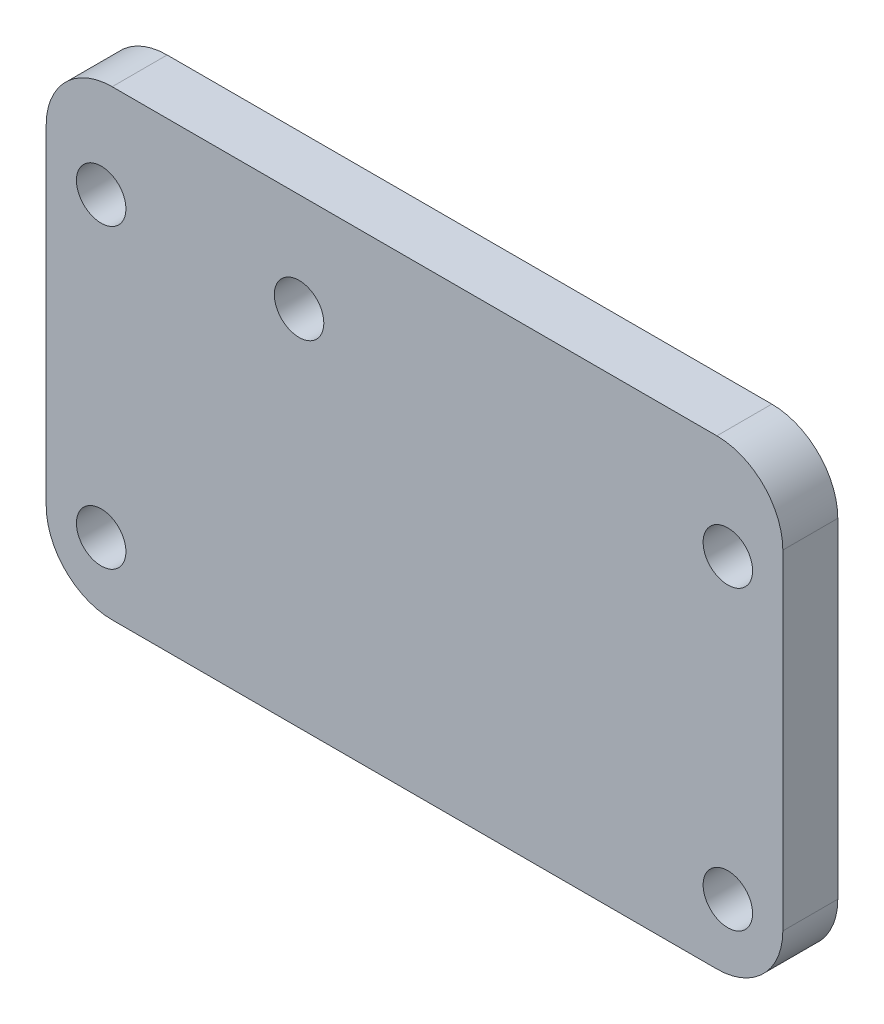
from build123d import *

# Parameters (mm, degrees)
SKETCH_1_W          = 67
SKETCH_1_H          = 42
EXTRUDE_1_DEPTH     = 5
SKETCH_2_R          = 2.25
CUT_EXTRUDE_1_DEPTH = 5
FILLET_1_R          = 6
SKETCH_4_R          = 2.25
CUT_EXTRUDE_2_DEPTH = 10
SKETCH_3_W          = 4
SKETCH_3_H          = 6
SKETCH_3_W_2        = 25
EXTRUDE_2_DEPTH     = 4


with BuildPart() as part:
    # Эскиз1 → Бобышка-Вытянуть1 (new body)
    with BuildSketch(Plane.XY):
        with Locations((33.5, 21)):
            Rectangle(SKETCH_1_W, SKETCH_1_H)
    extrude(amount=EXTRUDE_1_DEPTH)

    # Эскиз2 → Вырез-Вытянуть1 (cut)
    with BuildSketch(Plane(origin=(0, 0, 0), x_dir=(-1, 0, 0), z_dir=(0, 0, -1))):
        with Locations((-62, 6)):
            Circle(SKETCH_2_R)
        with Locations((-62, 33)):
            Circle(SKETCH_2_R)
        with Locations((-5, 6)):
            Circle(SKETCH_2_R)
        with Locations((-5, 33)):
            Circle(SKETCH_2_R)
    extrude(amount=-CUT_EXTRUDE_1_DEPTH, mode=Mode.SUBTRACT)

    # Скругление1
    fillet_1_edges = [part.edges().sort_by_distance(p)[0] for p in [
        (0, 42, 2.5),
        (67, 42, 2.5),
        (67, 0, 2.5),
        (0, 0, 2.5),
    ]]
    fillet(fillet_1_edges, radius=FILLET_1_R)

    # Эскиз4 → Вырез-Вытянуть2 (cut)
    with BuildSketch(Plane.XY.offset(5)):
        with Locations((23, 33)):
            Circle(SKETCH_4_R)
    extrude(amount=-CUT_EXTRUDE_2_DEPTH, mode=Mode.SUBTRACT)

    # Эскиз3 → Бобышка-Вытянуть2 (add)
    with BuildSketch(Plane(origin=(0, 0, 0), x_dir=(-1, 0, 0), z_dir=(0, 0, -1))):
        with Locations((-14, 33)):
            Rectangle(SKETCH_3_W, SKETCH_3_H)
        with Locations((-42.5, 33)):
            Rectangle(SKETCH_3_W_2, SKETCH_3_H)
    extrude(amount=EXTRUDE_2_DEPTH)


solid = part.part
